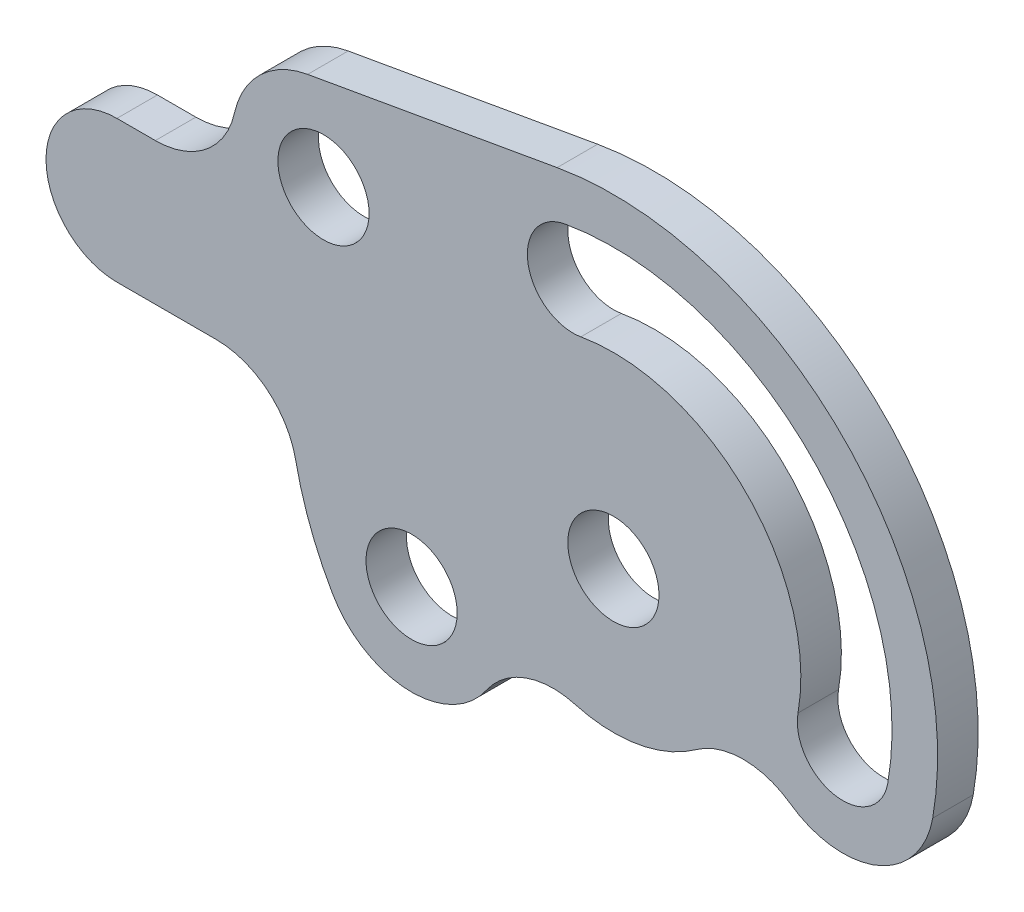
from build123d import *

# Parameters (mm, degrees)
SKETCH1_R           = 1.7859375
BOSS_EXTRUDE1_DEPTH = 1.5875
FILLET1_R           = 3.175


with BuildPart() as part:
    # Sketch1 → Boss-Extrude1 (new body)
    with BuildSketch(Plane.XY):
        with BuildLine():
            Line((-14.492018868, 5.55625), (-19.446875, 5.55625))
            ThreePointArc((-19.446875, 5.55625), (-22.225, 2.778125), (-19.446875, 0))
            Line((-19.446875, 0), (-12.7, 0))
            ThreePointArc((-12.7, 0), (-12.267257994, -3.287001873), (-10.998522628, -6.35))
            ThreePointArc((-10.998522628, -6.35), (-6.11925064, -7.65739699), (-4.811853648, -2.778125003))
            ThreePointArc((-4.811853648, -2.778125003), (0.964832728, -5.47183807), (5.471838092, -0.964832608))
            ThreePointArc((5.471838092, -0.964832608), (8.369198647, -5.102692458), (12.507058463, -2.205331856))
            ThreePointArc((12.507058463, -2.205331856), (8.980256121, 8.980256121), (-2.205331856, 12.507058463))
            Line((-2.205331856, 12.507058463), (-11.976471281, 10.78414295))
            ThreePointArc((-11.976471281, 10.78414295), (-14.574868615, 8.815275161), (-14.492018868, 5.55625))
        make_face()
        with BuildLine():
            ThreePointArc((-1.274957479, 7.230643174), (-3.343887368, 8.679323478), (-1.895207064, 10.748253367))
            ThreePointArc((-1.895207064, 10.748253367), (7.717407604, 7.717407604), (10.748253367, -1.895207064))
            ThreePointArc((10.748253367, -1.895207064), (8.679323478, -3.343887368), (7.230643174, -1.274957479))
            ThreePointArc((7.230643174, -1.274957479), (5.19171057, 5.19171057), (-1.274957479, 7.230643174))
        make_face(mode=Mode.SUBTRACT)
        with Locations((-11.356221696, 7.266532758)):
            Circle(SKETCH1_R, mode=Mode.SUBTRACT)
        Circle(SKETCH1_R, mode=Mode.SUBTRACT)
        with Locations((-7.905188139, -4.5640625)):
            Circle(SKETCH1_R, mode=Mode.SUBTRACT)
    extrude(amount=BOSS_EXTRUDE1_DEPTH)

    # Fillet1
    fillet1_edges = [part.edges().sort_by_distance(p)[0] for p in [
        (-4.811853648, -2.778125003, 0.79375),
        (-12.7, 0, 0.79375),
        (-14.492018868, 5.55625, 0.79375),
        (5.471838092, -0.964832608, 0.79375),
    ]]
    fillet(fillet1_edges, radius=FILLET1_R)


solid = part.part
